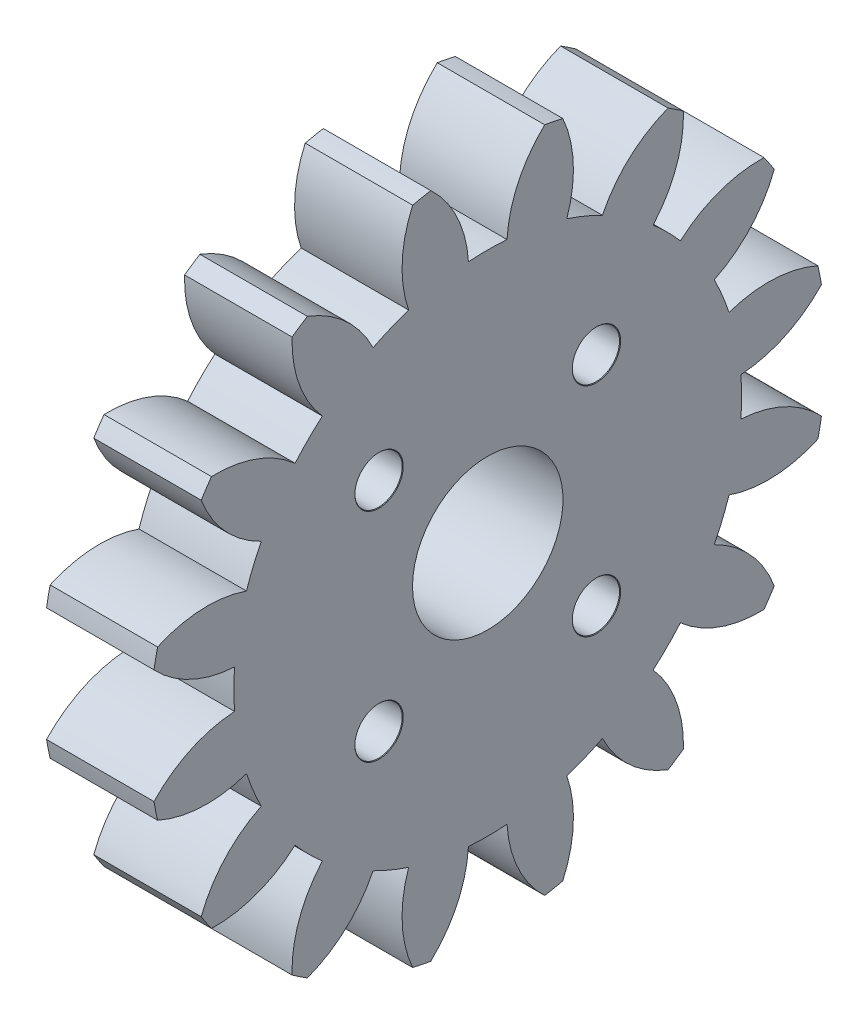
from build123d import *

# Parameters (mm, degrees)
BASPROSKE_W                    = 5
BASPROSKE_H                    = 15.75
TOOTHCUT_DEPTH                 = 23.828162432
TEETHCUTS_COUNT                = 16
TEETHCUTS_ANGLE                = 337.5
BORSKE_R                       = 3.5
BORE_DEPTH                     = 50.0000508
M2_CLEARANCE_HOLE1_D           = 2.2
M2_CLEARANCE_HOLE1_CSINK_D     = 2.25
M2_CLEARANCE_HOLE1_CSINK_ANGLE = 90


with BuildPart() as part:
    # BasProSke → Base-Revolve (revolve)
    with BuildSketch(Plane(origin=(0, 0, 0), x_dir=(1, 0, 0), z_dir=(0, 1, 0)), mode=Mode.PRIVATE) as base_revolve_sk:
        with Locations((2.5, 7.875)):
            Rectangle(BASPROSKE_W, BASPROSKE_H)
    revolve(base_revolve_sk.sketch.rotate(Axis((-10, 0, 0), (1, 0, 0)), 180), axis=Axis((-10, 0, 0), (1, 0, 0)))

    # TooCutSke → ToothCut (cut, through all)
    with BuildSketch(Plane(origin=(0, 0, 0), x_dir=(0, 0, -1), z_dir=(1, 0, 0))):
        with BuildLine():
            ThreePointArc((0.896728289, 11.777411032), (0, 11.8115), (-0.896728289, 11.777411032))
            ThreePointArc((-0.896728289, 11.777411032), (-1.421809307, 13.833768969), (-2.674397607, 15.547052537))
            ThreePointArc((-2.674397607, 15.547052537), (0, 15.7754), (2.674397607, 15.547052537))
            ThreePointArc((2.674397607, 15.547052537), (1.421809307, 13.833768969), (0.896728289, 11.777411032))
        make_face()
    toothcut = extrude(amount=TOOTHCUT_DEPTH, mode=Mode.SUBTRACT)

    # TeethCuts: ToothCut ×16 about axis
    teethcuts_axis = Axis((-10, 0, 0), (1, 0, 0))
    for i in range(1, TEETHCUTS_COUNT):
        add(toothcut.rotate(teethcuts_axis, i * TEETHCUTS_ANGLE / (TEETHCUTS_COUNT - 1)), mode=Mode.SUBTRACT)

    # BorSke → Bore (cut, symmetric)
    with BuildSketch(Plane(origin=(0, 0, 0), x_dir=(0, 0, -1), z_dir=(1, 0, 0))):
        with Locations(Location((0, 0, 0), (0, 0, 180))):
            Circle(BORSKE_R)
    extrude(amount=BORE_DEPTH, both=True, mode=Mode.SUBTRACT)

    # M2 Clearance Hole1 (through all)
    with Locations(Plane(origin=(5, 0, 0), x_dir=(0, 0, -1), z_dir=(1, 0, 0))):
        with Locations((-5.055813485, 5.055813485), (5.055813485, 5.055813485), (5.055813485, -5.055813485), (-5.055813485, -5.055813485)):
            CounterSinkHole(M2_CLEARANCE_HOLE1_D / 2, M2_CLEARANCE_HOLE1_CSINK_D / 2, counter_sink_angle=M2_CLEARANCE_HOLE1_CSINK_ANGLE)


solid = part.part
